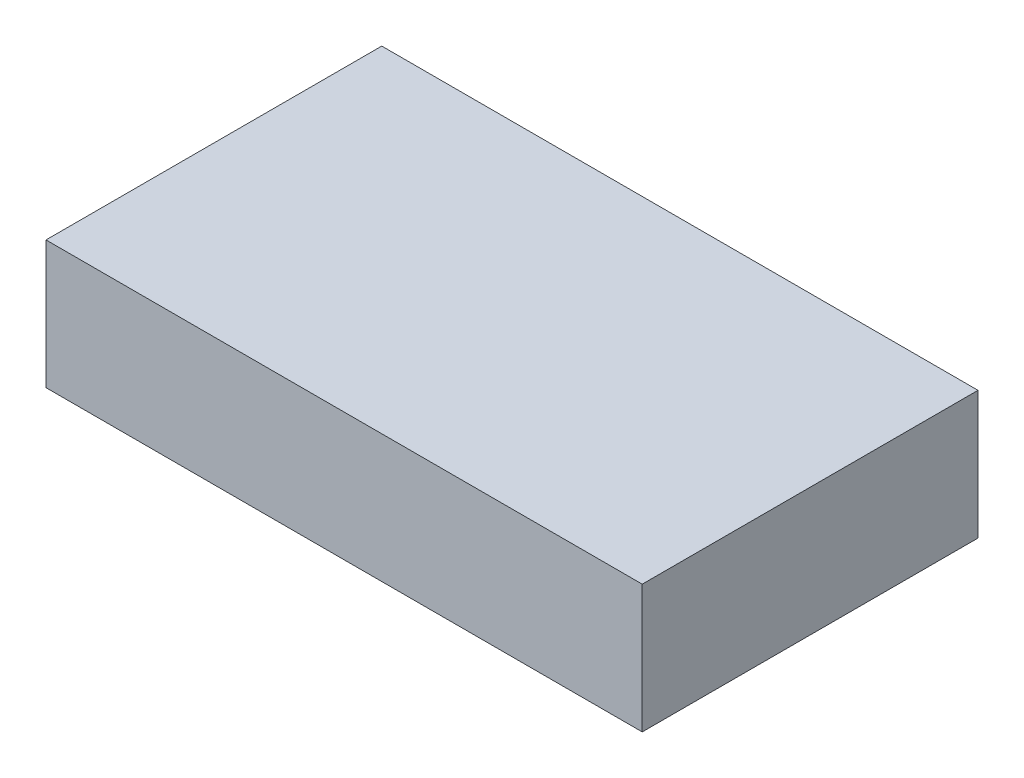
from build123d import *

# Parameters (mm, degrees)
SKETCH1_W           = 35.516554263
SKETCH1_H           = 7.623492881
BOSS_EXTRUDE1_DEPTH = 20


with BuildPart() as part:
    # Sketch1 → Boss-Extrude1 (new body)
    with BuildSketch(Plane.XY):
        with Locations((-9.449426403, 10.331585395)):
            Rectangle(SKETCH1_W, SKETCH1_H)
    extrude(amount=BOSS_EXTRUDE1_DEPTH)


solid = part.part
